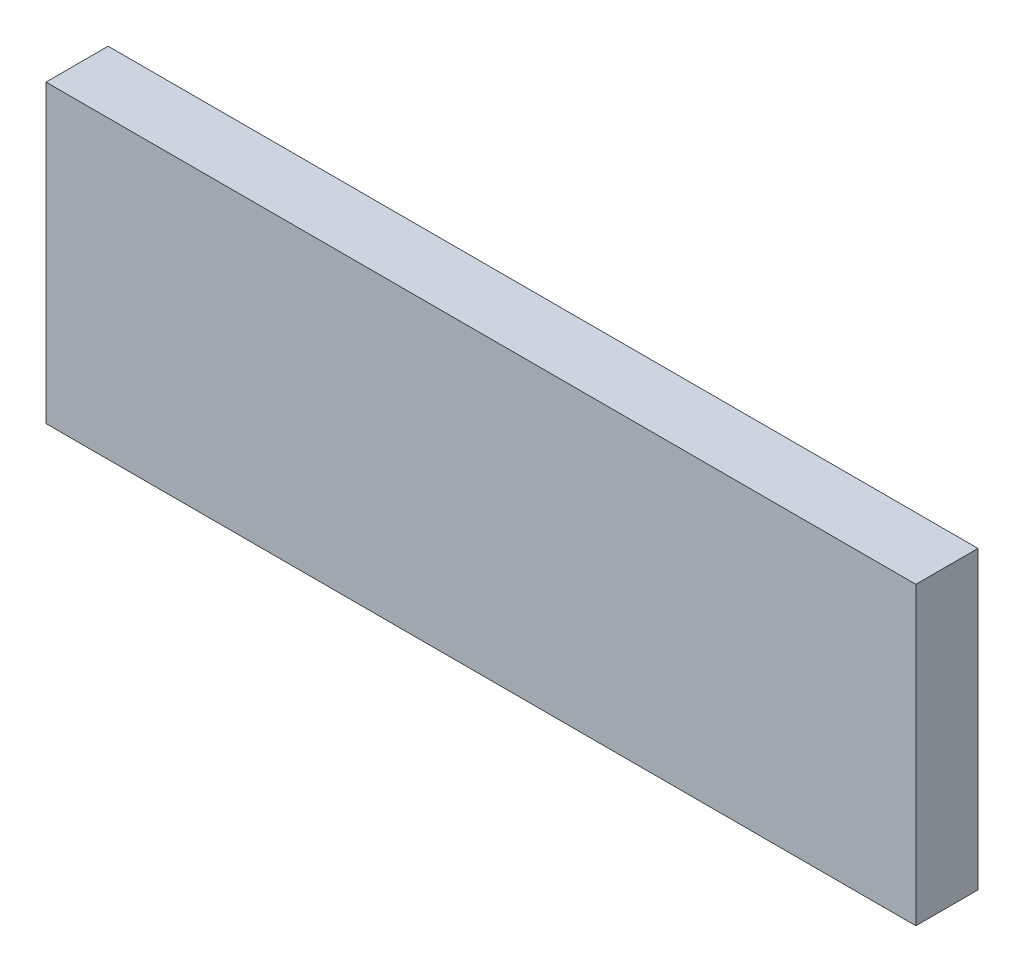
from build123d import *

# Parameters (mm, degrees)
ESQUISSE1_W        = 177.8
ESQUISSE1_H        = 60.452
BOSS_EXTRU_1_DEPTH = 12.7


with BuildPart() as part:
    # Esquisse1 → Boss.-Extru.1 (new body)
    with BuildSketch(Plane.XY):
        Rectangle(ESQUISSE1_W, ESQUISSE1_H)
    extrude(amount=BOSS_EXTRU_1_DEPTH)


solid = part.part
